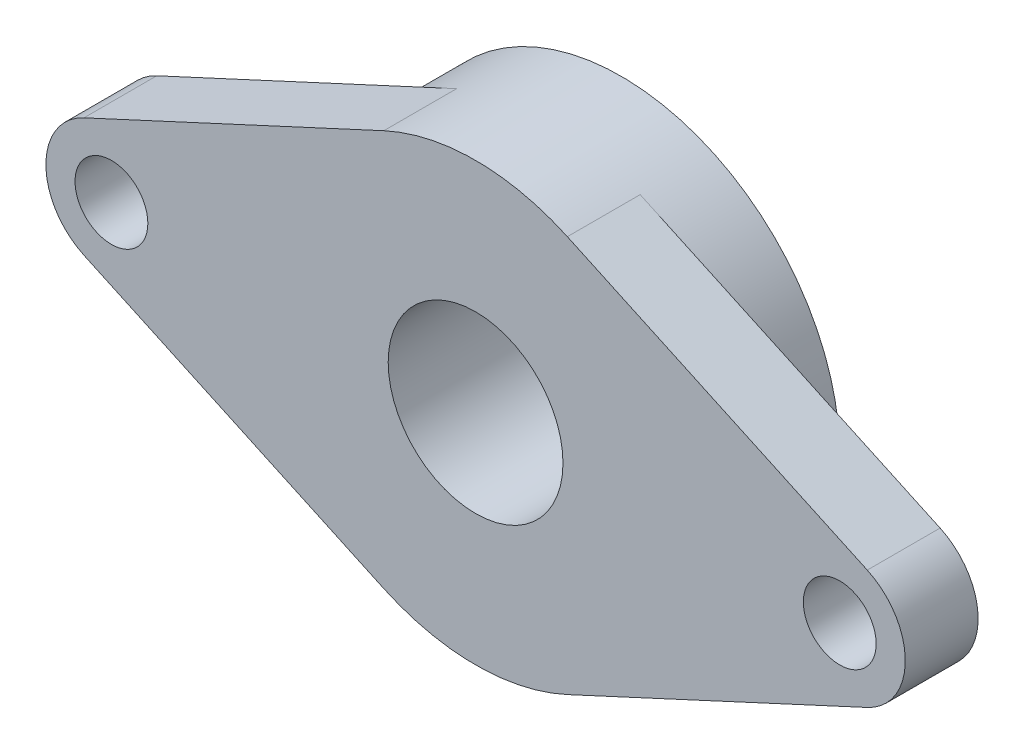
from build123d import *

# Parameters (mm, degrees)
SKETCH1_R           = 2.5
SKETCH1_R_2         = 6
BOSS_EXTRUDE1_DEPTH = 5
BOSS_EXTRUDE2_START = 5
SKETCH2_R           = 15
SKETCH2_R_2         = 6
BOSS_EXTRUDE2_DEPTH = 5
SCALE1_SCALE        = 0.666666667


with BuildPart() as part:
    # Sketch1 → Boss-Extrude1 (new body)
    with BuildSketch(Plane.XY):
        with BuildLine():
            Line((6.3, -13.612861565), (26.89, -4.08385847))
            ThreePointArc((26.89, -4.08385847), (29.5, 0), (26.89, 4.08385847))
            Line((26.89, 4.08385847), (6.3, 13.612861565))
            ThreePointArc((6.3, 13.612861565), (0, 15), (-6.3, 13.612861565))
            Line((-6.3, 13.612861565), (-26.89, 4.08385847))
            ThreePointArc((-26.89, 4.08385847), (-29.5, 0), (-26.89, -4.08385847))
            Line((-26.89, -4.08385847), (-6.3, -13.612861565))
            ThreePointArc((-6.3, -13.612861565), (0, -15), (6.3, -13.612861565))
        make_face()
        with Locations((25, 0)):
            Circle(SKETCH1_R, mode=Mode.SUBTRACT)
        Circle(SKETCH1_R_2, mode=Mode.SUBTRACT)
        with Locations((-25, 0)):
            Circle(SKETCH1_R, mode=Mode.SUBTRACT)
    extrude(amount=BOSS_EXTRUDE1_DEPTH)

    # Sketch2 → Boss-Extrude2 (add)
    with BuildSketch(Plane(origin=(0, 0, 0), x_dir=(-1, 0, 0), z_dir=(0, 0, -1)).offset(BOSS_EXTRUDE2_START)):
        Circle(SKETCH2_R)
        Circle(SKETCH2_R_2, mode=Mode.SUBTRACT)
    extrude(amount=-BOSS_EXTRUDE2_DEPTH)


with BuildPart() as part_1:
    # Scale1: scaled about (0, 0, 0.605835617)
    add(part.part.scale(SCALE1_SCALE).moved(Location((0, 0, 0.201945206))))


solid = part_1.part
